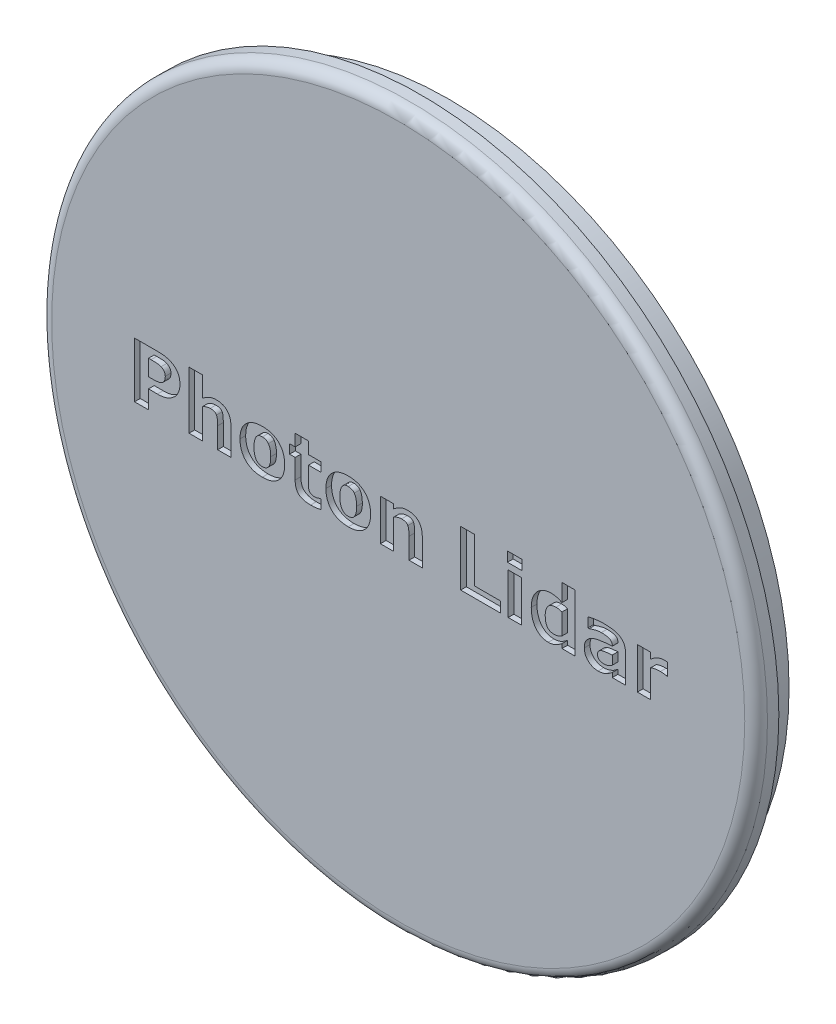
from build123d import *

# Parameters (mm, degrees)
ESBO_O1_R                = 31.5
RESSALTO_EXTRUS_O1_DEPTH = 2
ESBO_O3_R                = 29.9
ESBO_O3_R_2              = 28.4
RESSALTO_EXTRUS_O2_DEPTH = 2.5
FILETE1_R                = 1
ESBO_O6_W                = 1.167782709
ESBO_O6_H                = 3.626272622
ESBO_O6_W_2              = 1.290707204
ESBO_O6_H_2              = 0.86047147
CORTE_EXTRUS_O1_DEPTH    = 0.5


with BuildPart() as part:
    # Esboço1 → Ressalto-extrusão1 (new body)
    with BuildSketch(Plane.XY):
        Circle(ESBO_O1_R)
    extrude(amount=RESSALTO_EXTRUS_O1_DEPTH)

    # Esboço3 → Ressalto-extrusão2 (add)
    with BuildSketch(Plane(origin=(0, 0, 0), x_dir=(-1, 0, 0), z_dir=(0, 0, -1))):
        with Locations(Location((0, 0, 0), (0, 0, 180))):
            Circle(ESBO_O3_R)
        Circle(ESBO_O3_R_2, mode=Mode.SUBTRACT)
    extrude(amount=RESSALTO_EXTRUS_O2_DEPTH)

    # Filete1
    filete1_edges = [part.edges().sort_by_distance(p)[0] for p in [
        (-31.5, 0, 2),
    ]]
    fillet(filete1_edges, radius=FILETE1_R)

    # Esboço6 → Corte-extrusão1 (cut)
    # profile 1 of 12: a face of its own
    with BuildSketch(Plane.XY.offset(2)):
        with BuildLine():
            add(Edge.make_bspline(
                [(-19.206952445, 0.830485554), (-19.208048858, 0.776618625), (-19.210238032, 0.669064159), (-19.234110671, 0.508910752), (-19.268571468, 0.350088014), (-19.320080514, 0.195578514), (-19.381939229, 0.047692162), (-19.457919589, -0.089405093), (-19.545287152, -0.214933632), (-19.614491065, -0.288455918), (-19.648712351, -0.324812636)],
                knots=[0, 0, 0, 0, 1.019113673, 2.034833419, 3.059716062, 4.092791828, 5.113850101, 6.090481864, 7.05574463, 8, 8, 8, 8], degree=3))
            add(Edge.make_bspline(
                [(-19.648712351, -0.324812636), (-19.697828559, -0.370277733), (-19.795182329, -0.460394597), (-19.954261358, -0.577349265), (-20.121612581, -0.677553725), (-20.268921237, -0.745244208), (-20.391716518, -0.792474411), (-20.490207327, -0.819949152), (-20.592868266, -0.847155076), (-20.701896924, -0.866180132), (-20.816086317, -0.883461575), (-20.936135774, -0.892562826), (-21.061251787, -0.901604953), (-21.146515017, -0.901854222), (-21.190070285, -0.901981557)],
                knots=[0, 0, 0, 0, 1.421898893, 2.818361258, 4.188526452, 5.561662783, 6.259388046, 6.982920217, 7.733902613, 8.516058252, 9.334100428, 10.18803952, 11.074390857, 12, 12, 12, 12], degree=3))
            Line((-21.190070285, -0.901981557), (-21.972753597, -0.901981557))
            Line((-21.972753597, -0.901981557), (-21.972753597, -2.5))
            Line((-21.972753597, -2.5), (-23.201998554, -2.5))
            Line((-23.201998554, -2.5), (-23.201998554, 2.355517578))
            Line((-23.201998554, 2.355517578), (-21.14781499, 2.355517578))
            add(Edge.make_bspline(
                [(-21.14781499, 2.355517578), (-21.073837122, 2.354775146), (-20.931789006, 2.353349571), (-20.727567258, 2.337615558), (-20.541458368, 2.313399702), (-20.371736758, 2.279112776), (-20.216601418, 2.232630186), (-20.070630756, 2.179912054), (-19.934812818, 2.1141482), (-19.850017406, 2.062938935), (-19.808130057, 2.037642515)],
                knots=[0, 0, 0, 0, 1.27106079, 2.440619017, 3.517381815, 4.494852357, 5.412224011, 6.298180721, 7.159333057, 8, 8, 8, 8], degree=3))
            add(Edge.make_bspline(
                [(-19.808130057, 2.037642515), (-19.761322092, 2.004982545), (-19.668766306, 1.940402314), (-19.548967118, 1.822023059), (-19.443353895, 1.693015239), (-19.357739103, 1.548393224), (-19.289860323, 1.389950552), (-19.240881974, 1.216750581), (-19.212090158, 1.02832098), (-19.208700899, 0.897812405), (-19.206952445, 0.830485554)],
                knots=[0, 0, 0, 0, 0.969589194, 1.917218374, 2.854679868, 3.800052037, 4.766330684, 5.780154268, 6.854824506, 8, 8, 8, 8], degree=3))
        make_face()
        with BuildLine():
            add(Edge.make_bspline(
                [(-20.497659649, 0.796873387), (-20.498850267, 0.82899567), (-20.501187503, 0.892053152), (-20.522486184, 0.982933966), (-20.559095588, 1.06635688), (-20.607851462, 1.14129379), (-20.665429781, 1.207208593), (-20.728242767, 1.263406935), (-20.795597672, 1.309921299), (-20.844894468, 1.330965842), (-20.869314179, 1.341390489)],
                knots=[0, 0, 0, 0, 1.099847327, 2.159049679, 3.176161391, 4.2078443, 5.211073333, 6.166865038, 7.091936402, 8, 8, 8, 8], degree=3))
            add(Edge.make_bspline(
                [(-20.869314179, 1.341390489), (-20.901785853, 1.353177416), (-20.965661751, 1.376363795), (-21.063226084, 1.400648647), (-21.159317972, 1.419161912), (-21.257538656, 1.425579124), (-21.362266038, 1.429033429), (-21.479438417, 1.432280349), (-21.612304429, 1.432514694), (-21.706097609, 1.433213949), (-21.755715035, 1.433583861)],
                knots=[0, 0, 0, 0, 0.923486951, 1.81661585, 2.686744715, 3.537310919, 4.445705301, 5.490788035, 6.672604582, 8, 8, 8, 8], degree=3))
            Line((-21.755715035, 1.433583861), (-21.972753597, 1.433583861))
            Line((-21.972753597, 1.433583861), (-21.972753597, 0.019952161))
            Line((-21.972753597, 0.019952161), (-21.610702544, 0.019952161))
            add(Edge.make_bspline(
                [(-21.610702544, 0.019952161), (-21.559149777, 0.020086604), (-21.460780779, 0.020343139), (-21.320512876, 0.028599634), (-21.194509199, 0.039521872), (-21.081362183, 0.0553462), (-20.979211934, 0.078632273), (-20.8871836, 0.113200021), (-20.801994746, 0.154367544), (-20.752585088, 0.191655402), (-20.728143079, 0.21010099)],
                knots=[0, 0, 0, 0, 1.344387399, 2.565255935, 3.663631474, 4.642529432, 5.543743606, 6.389074971, 7.203106285, 8, 8, 8, 8], degree=3))
            add(Edge.make_bspline(
                [(-20.728143079, 0.21010099), (-20.708797806, 0.227575061), (-20.670878371, 0.261826678), (-20.622231075, 0.32065664), (-20.581702066, 0.383642832), (-20.550420481, 0.453070908), (-20.526744239, 0.528226302), (-20.509108133, 0.61081459), (-20.500233654, 0.701286066), (-20.498539333, 0.764205766), (-20.497659649, 0.796873387)],
                knots=[0, 0, 0, 0, 0.956932246, 1.875720723, 2.796014177, 3.701450989, 4.665012664, 5.687117245, 6.799161837, 8, 8, 8, 8], degree=3))
        make_face(mode=Mode.SUBTRACT)
    # profile 2 of 12: a face of its own
    with BuildSketch(Plane.XY.offset(2)):
        with BuildLine():
            Line((-14.720208354, -2.5), (-15.887991063, -2.5))
            Line((-15.887991063, -2.5), (-15.887991063, -0.675339518))
            add(Edge.make_bspline(
                [(-15.887991063, -0.675339518), (-15.888977907, -0.601027114), (-15.890946093, -0.452816693), (-15.907143123, -0.270405796), (-15.923346423, -0.132130824), (-15.941643134, -0.042980273), (-15.962530923, 0.032199453), (-15.982557295, 0.075206601), (-15.991708606, 0.094859275)],
                knots=[0, 0, 0, 0, 1.709235885, 3.408940626, 4.211008593, 4.910095588, 5.501954032, 6, 6, 6, 6], degree=3))
            add(Edge.make_bspline(
                [(-15.991708606, 0.094859275), (-16.003576873, 0.11419018), (-16.026846283, 0.152091143), (-16.072382072, 0.201230042), (-16.125630057, 0.241832553), (-16.187718705, 0.274119299), (-16.259806311, 0.297712177), (-16.342965508, 0.316486471), (-16.43939466, 0.324670939), (-16.507729672, 0.326365986), (-16.543908489, 0.3272634)],
                knots=[0, 0, 0, 0, 0.860145871, 1.686437142, 2.528070002, 3.393017362, 4.331453407, 5.402595683, 6.624848233, 8, 8, 8, 8], degree=3))
            add(Edge.make_bspline(
                [(-16.543908489, 0.3272634), (-16.598867591, 0.324516129), (-16.711089926, 0.31890641), (-16.850020414, 0.284257831), (-16.963002269, 0.244816604), (-17.052616717, 0.207223394), (-17.145674118, 0.1608714), (-17.207991003, 0.125568184), (-17.240160515, 0.107343794)],
                knots=[0, 0, 0, 0, 1.338419466, 2.732951426, 3.468143565, 4.254837763, 5.099104234, 6, 6, 6, 6], degree=3))
            Line((-17.240160515, 0.107343794), (-17.240160515, -2.5))
            Line((-17.240160515, -2.5), (-18.407943223, -2.5))
            Line((-18.407943223, -2.5), (-18.407943223, 2.539904322))
            Line((-18.407943223, 2.539904322), (-17.240160515, 2.539904322))
            Line((-17.240160515, 2.539904322), (-17.240160515, 0.745974963))
            add(Edge.make_bspline(
                [(-17.240160515, 0.745974963), (-17.188826165, 0.785131689), (-17.0889008, 0.861352585), (-16.934653027, 0.960085153), (-16.785554076, 1.047963052), (-16.637241233, 1.121384995), (-16.485530695, 1.179583232), (-16.326870303, 1.219184983), (-16.160971229, 1.245547932), (-16.047513669, 1.247966554), (-15.989787911, 1.249197117)],
                knots=[0, 0, 0, 0, 1.126064518, 2.191951536, 3.19307265, 4.144813015, 5.076393104, 6.021983703, 6.993610568, 8, 8, 8, 8], degree=3))
            add(Edge.make_bspline(
                [(-15.989787911, 1.249197117), (-15.941413778, 1.247964349), (-15.846978865, 1.245557766), (-15.70933656, 1.230519765), (-15.579625261, 1.20378216), (-15.458612419, 1.165043418), (-15.344866267, 1.117186796), (-15.239892077, 1.057390595), (-15.143168911, 0.986575809), (-15.054382413, 0.905928509), (-14.975228688, 0.814161261), (-14.906305299, 0.711400398), (-14.84942663, 0.597357469), (-14.800442621, 0.473680814), (-14.764792186, 0.338805678), (-14.739230262, 0.193588507), (-14.722215085, 0.037960322), (-14.720890645, -0.069633092), (-14.720208354, -0.12506033)],
                knots=[0, 0, 0, 0, 1.088441561, 2.124831547, 3.110816719, 4.062969431, 4.979391633, 5.88258537, 6.774334107, 7.671621258, 8.575503974, 9.49441354, 10.447872957, 11.437639084, 12.482478955, 13.580222388, 14.753440527, 16, 16, 16, 16], degree=3))
            Line((-14.720208354, -0.12506033), (-14.720208354, -2.5))
        make_face()
    # profile 3 of 12: a face of its own
    with BuildSketch(Plane.XY.offset(2)):
        with BuildLine():
            add(Edge.make_bspline(
                [(-9.987615271, -0.688784384), (-9.988825259, -0.761851758), (-9.991183849, -0.90427968), (-10.017219524, -1.111747201), (-10.057202897, -1.307446002), (-10.112231674, -1.491996337), (-10.185931312, -1.664029553), (-10.275390051, -1.824065178), (-10.38092914, -1.972264438), (-10.501846993, -2.107744375), (-10.637873619, -2.229044521), (-10.787120848, -2.335681074), (-10.950745309, -2.423422602), (-11.125968599, -2.497544478), (-11.314814588, -2.553679172), (-11.516760159, -2.593394902), (-11.731253116, -2.619339462), (-11.878781486, -2.621709547), (-11.954407202, -2.622924496)],
                knots=[0, 0, 0, 0, 1.120122129, 2.18341868, 3.201215738, 4.181270334, 5.131540819, 6.065757527, 6.988093576, 7.916512302, 8.844931028, 9.778115023, 10.722851943, 11.686686084, 12.691660064, 13.738321946, 14.84062285, 16, 16, 16, 16], degree=3))
            add(Edge.make_bspline(
                [(-11.954407202, -2.622924496), (-12.030034234, -2.621713541), (-12.177565173, -2.619351247), (-12.3920399, -2.593351385), (-12.593748756, -2.553889758), (-12.782368707, -2.497117338), (-12.957862208, -2.423697523), (-13.121678979, -2.335645543), (-13.270946427, -2.229054649), (-13.406959295, -2.107739029), (-13.527912032, -1.972275685), (-13.633325554, -1.824025579), (-13.723198224, -1.664289127), (-13.795078937, -1.491565033), (-13.852011406, -1.307676459), (-13.89147606, -1.111707885), (-13.917662688, -0.904290312), (-13.92000004, -0.761855363), (-13.921199132, -0.688784384)],
                knots=[0, 0, 0, 0, 1.159424321, 2.261770074, 3.308474541, 4.308788811, 5.277191138, 6.221966496, 7.15518846, 8.08364496, 9.01210146, 9.934475036, 10.868729753, 11.817121636, 12.798654016, 13.816492484, 14.879832297, 16, 16, 16, 16], degree=3))
            add(Edge.make_bspline(
                [(-13.921199132, -0.688784384), (-13.919979282, -0.61539694), (-13.917595946, -0.472012996), (-13.891600963, -0.26328048), (-13.851882001, -0.066114883), (-13.795556431, 0.118798433), (-13.721933533, 0.291246989), (-13.632542248, 0.451581261), (-13.525892372, 0.599508239), (-13.404043214, 0.734965129), (-13.267516082, 0.856177349), (-13.117289685, 0.961683154), (-12.954536659, 1.050862369), (-12.779388454, 1.124755256), (-12.590676086, 1.179844262), (-12.389806096, 1.219541949), (-12.176289876, 1.24566814), (-12.02971451, 1.247999377), (-11.954407202, 1.249197117)],
                knots=[0, 0, 0, 0, 1.124034801, 2.196132384, 3.217834281, 4.203147447, 5.152578239, 6.085969439, 7.010345409, 7.941219594, 8.872481455, 9.802010446, 10.748267785, 11.711250247, 12.709230373, 13.754967386, 14.846549946, 16, 16, 16, 16], degree=3))
            add(Edge.make_bspline(
                [(-11.954407202, 1.249197117), (-11.878139461, 1.247997218), (-11.729649183, 1.24566106), (-11.513902566, 1.219619029), (-11.311226941, 1.180166679), (-11.121977856, 1.123450843), (-10.946013521, 1.050459321), (-10.783490772, 0.96039206), (-10.633700069, 0.854816111), (-10.499286599, 0.731979848), (-10.378687253, 0.596270366), (-10.273693662, 0.447804175), (-10.184571778, 0.287204252), (-10.112916848, 0.114256767), (-10.055903242, -0.069895147), (-10.016067998, -0.265787446), (-9.991491716, -0.473356291), (-9.988929876, -0.615727009), (-9.987615271, -0.688784384)],
                knots=[0, 0, 0, 0, 1.167473013, 2.273023816, 3.322954552, 4.326451713, 5.293391623, 6.234801871, 7.166614545, 8.093305908, 9.017100806, 9.942078766, 10.872536262, 11.824015763, 12.804065898, 13.820367293, 14.881523901, 16, 16, 16, 16], degree=3))
        make_face()
        with BuildLine():
            add(Edge.make_bspline(
                [(-11.4300574, -1.586709411), (-11.412832655, -1.562422446), (-11.37777826, -1.512995599), (-11.33524684, -1.430685251), (-11.298361731, -1.341767747), (-11.268321291, -1.24338122), (-11.243551249, -1.131812233), (-11.228906046, -1.002804439), (-11.2176017, -0.855445024), (-11.2171171, -0.750915046), (-11.216860228, -0.695506818)],
                knots=[0, 0, 0, 0, 0.765094823, 1.557058493, 2.376706509, 3.238810155, 4.199844458, 5.312104478, 6.575226644, 8, 8, 8, 8], degree=3))
            add(Edge.make_bspline(
                [(-11.216860228, -0.695506818), (-11.21771912, -0.64331575), (-11.219364662, -0.543323349), (-11.228413882, -0.399611527), (-11.245343832, -0.2693173), (-11.269518399, -0.151940196), (-11.299125904, -0.046542064), (-11.334373821, 0.04776968), (-11.375088194, 0.131216702), (-11.40837116, 0.180025911), (-11.424295314, 0.203378557)],
                knots=[0, 0, 0, 0, 1.337076348, 2.561692668, 3.686680134, 4.69989255, 5.629188848, 6.488203485, 7.276684665, 8, 8, 8, 8], degree=3))
            add(Edge.make_bspline(
                [(-11.424295314, 0.203378557), (-11.440734797, 0.224637812), (-11.472841913, 0.266158182), (-11.529056845, 0.319745328), (-11.591230855, 0.362374318), (-11.658278113, 0.394841465), (-11.728231987, 0.419775001), (-11.801362019, 0.437062648), (-11.876941065, 0.447801268), (-11.928442518, 0.449387959), (-11.954407202, 0.450187896)],
                knots=[0, 0, 0, 0, 1.058499091, 2.067300666, 3.047512573, 4.018335651, 4.996351322, 5.969796037, 6.97646375, 8, 8, 8, 8], degree=3))
            add(Edge.make_bspline(
                [(-11.954407202, 0.450187896), (-11.980039601, 0.449652338), (-12.030175704, 0.448604804), (-12.103157884, 0.439936883), (-12.171895169, 0.425370399), (-12.237209909, 0.405745098), (-12.299610502, 0.376059615), (-12.359395377, 0.334845126), (-12.418408691, 0.282571603), (-12.454258351, 0.241283431), (-12.472994918, 0.219704466)],
                knots=[0, 0, 0, 0, 1.04189444, 2.037910168, 2.982338511, 3.896140384, 4.804271323, 5.778885192, 6.839150358, 8, 8, 8, 8], degree=3))
            add(Edge.make_bspline(
                [(-12.472994918, 0.219704466), (-12.489281959, 0.19670546), (-12.523464335, 0.148436369), (-12.564696838, 0.06490352), (-12.602050286, -0.029560145), (-12.635033279, -0.135951118), (-12.660825052, -0.255762952), (-12.678216946, -0.3897079), (-12.690097439, -0.53779801), (-12.691316943, -0.641381082), (-12.691954176, -0.695506818)],
                knots=[0, 0, 0, 0, 0.70629823, 1.482341141, 2.329662943, 3.254583898, 4.274063958, 5.401087491, 6.641978366, 8, 8, 8, 8], degree=3))
            add(Edge.make_bspline(
                [(-12.691954176, -0.695506818), (-12.691665746, -0.744194983), (-12.691107107, -0.83849553), (-12.67934728, -0.974563245), (-12.665420318, -1.101216709), (-12.641794844, -1.217169049), (-12.614029148, -1.323270676), (-12.577707763, -1.418030632), (-12.537730342, -1.503248516), (-12.503724525, -1.553150591), (-12.487400132, -1.577105935)],
                knots=[0, 0, 0, 0, 1.270983191, 2.461674417, 3.564986371, 4.596265355, 5.549463796, 6.425202083, 7.244022889, 8, 8, 8, 8], degree=3))
            add(Edge.make_bspline(
                [(-12.487400132, -1.577105935), (-12.470873776, -1.59734251), (-12.438291019, -1.637240196), (-12.382559616, -1.689492394), (-12.320992981, -1.731956671), (-12.255462021, -1.767061551), (-12.184251402, -1.793008602), (-12.108491482, -1.810970783), (-12.028013714, -1.821611137), (-11.973006223, -1.823134329), (-11.944803726, -1.823915274)],
                knots=[0, 0, 0, 0, 1.010886179, 1.993025998, 2.945391046, 3.898964935, 4.863589088, 5.87059323, 6.908247091, 8, 8, 8, 8], degree=3))
            add(Edge.make_bspline(
                [(-11.944803726, -1.823915274), (-11.895878166, -1.821365089), (-11.798874306, -1.816308882), (-11.681593093, -1.781523631), (-11.594113276, -1.740010011), (-11.533186339, -1.698281246), (-11.477915513, -1.646775459), (-11.446215547, -1.606989275), (-11.4300574, -1.586709411)],
                knots=[0, 0, 0, 0, 1.49343762, 2.961012893, 3.700518105, 4.446788108, 5.208294864, 6, 6, 6, 6], degree=3))
        make_face(mode=Mode.SUBTRACT)
    # profile 4 of 12: a face of its own
    with BuildSketch(Plane.XY.offset(2)):
        with BuildLine():
            add(Edge.make_bspline(
                [(-6.791578385, -2.517286257), (-6.856389396, -2.532833491), (-6.989026629, -2.564651264), (-7.161085145, -2.592081043), (-7.308659943, -2.608734961), (-7.432657913, -2.617187208), (-7.568145655, -2.621643106), (-7.662610415, -2.622486952), (-7.711591407, -2.622924496)],
                knots=[0, 0, 0, 0, 1.291346877, 2.642771225, 3.373109244, 4.169185184, 5.05070288, 6, 6, 6, 6], degree=3))
            add(Edge.make_bspline(
                [(-7.711591407, -2.622924496), (-7.766992531, -2.621885573), (-7.874098139, -2.619877051), (-8.029436992, -2.607803662), (-8.173594634, -2.586005989), (-8.306924675, -2.554779243), (-8.430084962, -2.517714854), (-8.541510816, -2.468987397), (-8.642151841, -2.412307205), (-8.732686204, -2.346601473), (-8.812941658, -2.270196016), (-8.880052018, -2.180184739), (-8.93867052, -2.079350092), (-8.98497835, -1.965374293), (-9.021795941, -1.839252655), (-9.046550222, -1.700795987), (-9.063790848, -1.550328062), (-9.065035851, -1.44591249), (-9.065681554, -1.391758844)],
                knots=[0, 0, 0, 0, 1.254406373, 2.425112466, 3.525000251, 4.551745933, 5.523718452, 6.432597655, 7.299226815, 8.134243947, 8.959515926, 9.797390618, 10.667618965, 11.593675357, 12.575328045, 13.637210109, 14.77457275, 16, 16, 16, 16], degree=3))
            Line((-9.065681554, -1.391758844), (-9.065681554, 0.3272634))
            Line((-9.065681554, 0.3272634), (-9.557379537, 0.3272634))
            Line((-9.557379537, 0.3272634), (-9.557379537, 1.126272622))
            Line((-9.557379537, 1.126272622), (-9.065681554, 1.126272622))
            Line((-9.065681554, 1.126272622), (-9.065681554, 2.171130835))
            Line((-9.065681554, 2.171130835), (-7.897898845, 2.171130835))
            Line((-7.897898845, 2.171130835), (-7.897898845, 1.126272622))
            Line((-7.897898845, 1.126272622), (-6.791578385, 1.126272622))
            Line((-6.791578385, 1.126272622), (-6.791578385, 0.3272634))
            Line((-6.791578385, 0.3272634), (-7.897898845, 0.3272634))
            Line((-7.897898845, 0.3272634), (-7.897898845, -0.977849019))
            add(Edge.make_bspline(
                [(-7.897898845, -0.977849019), (-7.897439036, -1.038049324), (-7.896578092, -1.150767952), (-7.897433319, -1.308970233), (-7.88589055, -1.450406862), (-7.856404595, -1.533966874), (-7.842198683, -1.574224892)],
                knots=[0, 0, 0, 0, 1.197914148, 2.242966005, 3.153486173, 4, 4, 4, 4], degree=3))
            add(Edge.make_bspline(
                [(-7.842198683, -1.574224892), (-7.833547826, -1.592832325), (-7.816483077, -1.629537491), (-7.779424592, -1.678790095), (-7.734176131, -1.722144155), (-7.678852471, -1.759394489), (-7.612418354, -1.79001797), (-7.532422205, -1.808290505), (-7.440656916, -1.822828982), (-7.374904496, -1.823538139), (-7.339936877, -1.823915274)],
                knots=[0, 0, 0, 0, 0.820729904, 1.618978142, 2.454031123, 3.322534162, 4.281603911, 5.367896211, 6.600227895, 8, 8, 8, 8], degree=3))
            add(Edge.make_bspline(
                [(-7.339936877, -1.823915274), (-7.323270341, -1.82321079), (-7.287552332, -1.821701011), (-7.230699282, -1.813622442), (-7.166937941, -1.799848654), (-7.099228849, -1.78109637), (-7.033186978, -1.761118491), (-6.974997131, -1.74113767), (-6.928340357, -1.721715244), (-6.901929333, -1.707252634), (-6.89049419, -1.700990778)],
                knots=[0, 0, 0, 0, 0.852790225, 1.827612483, 2.932246577, 4.187288435, 5.419917027, 6.460703747, 7.333533122, 8, 8, 8, 8], degree=3))
            Line((-6.89049419, -1.700990778), (-6.791578385, -1.700990778))
            Line((-6.791578385, -1.700990778), (-6.791578385, -2.517286257))
        make_face()
    # profile 5 of 12: a face of its own
    with BuildSketch(Plane.XY.offset(2)):
        with BuildLine():
            add(Edge.make_bspline(
                [(-2.427758789, -0.688784384), (-2.428968777, -0.761851758), (-2.431327367, -0.90427968), (-2.457363042, -1.111747201), (-2.497346415, -1.307446002), (-2.552375191, -1.491996337), (-2.626074829, -1.664029553), (-2.715533569, -1.824065178), (-2.821072658, -1.972264438), (-2.941990511, -2.107744375), (-3.078017137, -2.229044521), (-3.227264366, -2.335681074), (-3.390888827, -2.423422602), (-3.566112116, -2.497544478), (-3.754958106, -2.553679172), (-3.956903677, -2.593394902), (-4.171396634, -2.619339462), (-4.318925004, -2.621709547), (-4.394550719, -2.622924496)],
                knots=[0, 0, 0, 0, 1.120122129, 2.18341868, 3.201215738, 4.181270334, 5.131540819, 6.065757527, 6.988093576, 7.916512302, 8.844931028, 9.778115023, 10.722851943, 11.686686084, 12.691660064, 13.738321946, 14.84062285, 16, 16, 16, 16], degree=3))
            add(Edge.make_bspline(
                [(-4.394550719, -2.622924496), (-4.470177752, -2.621713541), (-4.61770869, -2.619351247), (-4.832183417, -2.593351385), (-5.033892274, -2.553889758), (-5.222512225, -2.497117338), (-5.398005725, -2.423697523), (-5.561822496, -2.335645543), (-5.711089945, -2.229054649), (-5.847102812, -2.107739029), (-5.96805555, -1.972275685), (-6.073469072, -1.824025579), (-6.163341742, -1.664289127), (-6.235222454, -1.491565033), (-6.292154924, -1.307676459), (-6.331619578, -1.111707885), (-6.357806206, -0.904290312), (-6.360143558, -0.761855363), (-6.36134265, -0.688784384)],
                knots=[0, 0, 0, 0, 1.159424321, 2.261770074, 3.308474541, 4.308788811, 5.277191138, 6.221966496, 7.15518846, 8.08364496, 9.01210146, 9.934475036, 10.868729753, 11.817121636, 12.798654016, 13.816492484, 14.879832297, 16, 16, 16, 16], degree=3))
            add(Edge.make_bspline(
                [(-6.36134265, -0.688784384), (-6.3601228, -0.61539694), (-6.357739464, -0.472012996), (-6.331744481, -0.26328048), (-6.292025519, -0.066114883), (-6.235699949, 0.118798433), (-6.16207705, 0.291246989), (-6.072685765, 0.451581261), (-5.96603589, 0.599508239), (-5.844186732, 0.734965129), (-5.7076596, 0.856177349), (-5.557433203, 0.961683154), (-5.394680176, 1.050862369), (-5.219531972, 1.124755256), (-5.030819604, 1.179844262), (-4.829949614, 1.219541949), (-4.616433394, 1.24566814), (-4.469858028, 1.247999377), (-4.394550719, 1.249197117)],
                knots=[0, 0, 0, 0, 1.124034801, 2.196132384, 3.217834281, 4.203147447, 5.152578239, 6.085969439, 7.010345409, 7.941219594, 8.872481455, 9.802010446, 10.748267785, 11.711250247, 12.709230373, 13.754967386, 14.846549946, 16, 16, 16, 16], degree=3))
            add(Edge.make_bspline(
                [(-4.394550719, 1.249197117), (-4.318282978, 1.247997218), (-4.169792701, 1.24566106), (-3.954046084, 1.219619029), (-3.751370459, 1.180166679), (-3.562121374, 1.123450843), (-3.386157039, 1.050459321), (-3.223634289, 0.96039206), (-3.073843587, 0.854816111), (-2.939430117, 0.731979848), (-2.818830771, 0.596270366), (-2.713837179, 0.447804175), (-2.624715296, 0.287204252), (-2.553060365, 0.114256767), (-2.49604676, -0.069895147), (-2.456211516, -0.265787446), (-2.431635233, -0.473356291), (-2.429073394, -0.615727009), (-2.427758789, -0.688784384)],
                knots=[0, 0, 0, 0, 1.167473013, 2.273023816, 3.322954552, 4.326451713, 5.293391623, 6.234801871, 7.166614545, 8.093305908, 9.017100806, 9.942078766, 10.872536262, 11.824015763, 12.804065898, 13.820367293, 14.881523901, 16, 16, 16, 16], degree=3))
        make_face()
        with BuildLine():
            add(Edge.make_bspline(
                [(-3.870200918, -1.586709411), (-3.852976172, -1.562422446), (-3.817921777, -1.512995599), (-3.775390357, -1.430685251), (-3.738505248, -1.341767747), (-3.708464809, -1.24338122), (-3.683694766, -1.131812233), (-3.669049564, -1.002804439), (-3.657745217, -0.855445024), (-3.657260617, -0.750915046), (-3.657003746, -0.695506818)],
                knots=[0, 0, 0, 0, 0.765094823, 1.557058493, 2.376706509, 3.238810155, 4.199844458, 5.312104478, 6.575226644, 8, 8, 8, 8], degree=3))
            add(Edge.make_bspline(
                [(-3.657003746, -0.695506818), (-3.657862637, -0.64331575), (-3.65950818, -0.543323349), (-3.668557399, -0.399611527), (-3.68548735, -0.2693173), (-3.709661917, -0.151940196), (-3.739269422, -0.046542064), (-3.774517339, 0.04776968), (-3.815231711, 0.131216702), (-3.848514678, 0.180025911), (-3.864438832, 0.203378557)],
                knots=[0, 0, 0, 0, 1.337076348, 2.561692668, 3.686680134, 4.69989255, 5.629188848, 6.488203485, 7.276684665, 8, 8, 8, 8], degree=3))
            add(Edge.make_bspline(
                [(-3.864438832, 0.203378557), (-3.880878315, 0.224637812), (-3.912985431, 0.266158182), (-3.969200363, 0.319745328), (-4.031374373, 0.362374318), (-4.09842163, 0.394841465), (-4.168375505, 0.419775001), (-4.241505537, 0.437062648), (-4.317084583, 0.447801268), (-4.368586036, 0.449387959), (-4.394550719, 0.450187896)],
                knots=[0, 0, 0, 0, 1.058499091, 2.067300666, 3.047512573, 4.018335651, 4.996351322, 5.969796037, 6.97646375, 8, 8, 8, 8], degree=3))
            add(Edge.make_bspline(
                [(-4.394550719, 0.450187896), (-4.420183119, 0.449652338), (-4.470319222, 0.448604804), (-4.543301402, 0.439936883), (-4.612038686, 0.425370399), (-4.677353426, 0.405745098), (-4.73975402, 0.376059615), (-4.799538894, 0.334845126), (-4.858552208, 0.282571603), (-4.894401869, 0.241283431), (-4.913138435, 0.219704466)],
                knots=[0, 0, 0, 0, 1.04189444, 2.037910168, 2.982338511, 3.896140384, 4.804271323, 5.778885192, 6.839150358, 8, 8, 8, 8], degree=3))
            add(Edge.make_bspline(
                [(-4.913138435, 0.219704466), (-4.929425477, 0.19670546), (-4.963607853, 0.148436369), (-5.004840355, 0.06490352), (-5.042193803, -0.029560145), (-5.075176797, -0.135951118), (-5.10096857, -0.255762952), (-5.118360464, -0.3897079), (-5.130240956, -0.53779801), (-5.13146046, -0.641381082), (-5.132097693, -0.695506818)],
                knots=[0, 0, 0, 0, 0.70629823, 1.482341141, 2.329662943, 3.254583898, 4.274063958, 5.401087491, 6.641978366, 8, 8, 8, 8], degree=3))
            add(Edge.make_bspline(
                [(-5.132097693, -0.695506818), (-5.131809263, -0.744194983), (-5.131250625, -0.83849553), (-5.119490797, -0.974563245), (-5.105563836, -1.101216709), (-5.081938361, -1.217169049), (-5.054172665, -1.323270676), (-5.01785128, -1.418030632), (-4.977873859, -1.503248516), (-4.943868042, -1.553150591), (-4.92754365, -1.577105935)],
                knots=[0, 0, 0, 0, 1.270983191, 2.461674417, 3.564986371, 4.596265355, 5.549463796, 6.425202083, 7.244022889, 8, 8, 8, 8], degree=3))
            add(Edge.make_bspline(
                [(-4.92754365, -1.577105935), (-4.911017293, -1.59734251), (-4.878434537, -1.637240196), (-4.822703133, -1.689492394), (-4.761136498, -1.731956671), (-4.695605538, -1.767061551), (-4.62439492, -1.793008602), (-4.548635, -1.810970783), (-4.468157232, -1.821611137), (-4.413149741, -1.823134329), (-4.384947243, -1.823915274)],
                knots=[0, 0, 0, 0, 1.010886179, 1.993025998, 2.945391046, 3.898964935, 4.863589088, 5.87059323, 6.908247091, 8, 8, 8, 8], degree=3))
            add(Edge.make_bspline(
                [(-4.384947243, -1.823915274), (-4.336021683, -1.821365089), (-4.239017823, -1.816308882), (-4.121736611, -1.781523631), (-4.034256793, -1.740010011), (-3.973329857, -1.698281246), (-3.918059031, -1.646775459), (-3.886359065, -1.606989275), (-3.870200918, -1.586709411)],
                knots=[0, 0, 0, 0, 1.49343762, 2.961012893, 3.700518105, 4.446788108, 5.208294864, 6, 6, 6, 6], degree=3))
        make_face(mode=Mode.SUBTRACT)
    # profile 6 of 12: a face of its own
    with BuildSketch(Plane.XY.offset(2)):
        with BuildLine():
            Line((2.12044755, -2.5), (0.952664841, -2.5))
            Line((0.952664841, -2.5), (0.952664841, -0.675339518))
            add(Edge.make_bspline(
                [(0.952664841, -0.675339518), (0.951677997, -0.601027114), (0.94970981, -0.452816693), (0.933512781, -0.270405796), (0.91730948, -0.132130824), (0.89901277, -0.042980273), (0.878124981, 0.032199453), (0.858098609, 0.075206601), (0.848947298, 0.094859275)],
                knots=[0, 0, 0, 0, 1.709235885, 3.408940626, 4.211008593, 4.910095588, 5.501954032, 6, 6, 6, 6], degree=3))
            add(Edge.make_bspline(
                [(0.848947298, 0.094859275), (0.837079031, 0.11419018), (0.813809621, 0.152091143), (0.768273832, 0.201230042), (0.715025847, 0.241832553), (0.652937199, 0.274119299), (0.580849593, 0.297712177), (0.497690396, 0.316486471), (0.401261244, 0.324670939), (0.332926231, 0.326365986), (0.296747415, 0.3272634)],
                knots=[0, 0, 0, 0, 0.860145871, 1.686437142, 2.528070002, 3.393017362, 4.331453407, 5.402595683, 6.624848233, 8, 8, 8, 8], degree=3))
            add(Edge.make_bspline(
                [(0.296747415, 0.3272634), (0.241788313, 0.324516129), (0.129565978, 0.31890641), (-0.009364511, 0.284257831), (-0.122346365, 0.244816604), (-0.211960813, 0.207223394), (-0.305018214, 0.1608714), (-0.367335099, 0.125568184), (-0.399504611, 0.107343794)],
                knots=[0, 0, 0, 0, 1.338419466, 2.732951426, 3.468143565, 4.254837763, 5.099104234, 6, 6, 6, 6], degree=3))
            Line((-0.399504611, 0.107343794), (-0.399504611, -2.5))
            Line((-0.399504611, -2.5), (-1.56728732, -2.5))
            Line((-1.56728732, -2.5), (-1.56728732, 1.126272622))
            Line((-1.56728732, 1.126272622), (-0.399504611, 1.126272622))
            Line((-0.399504611, 1.126272622), (-0.399504611, 0.745974963))
            add(Edge.make_bspline(
                [(-0.399504611, 0.745974963), (-0.348170261, 0.785131689), (-0.248244896, 0.861352585), (-0.093997123, 0.960085153), (0.055101827, 1.047963052), (0.203414671, 1.121384995), (0.355125209, 1.179583232), (0.513785601, 1.219184983), (0.679684675, 1.245547932), (0.793142235, 1.247966554), (0.850867993, 1.249197117)],
                knots=[0, 0, 0, 0, 1.126064518, 2.191951536, 3.19307265, 4.144813015, 5.076393104, 6.021983703, 6.993610568, 8, 8, 8, 8], degree=3))
            add(Edge.make_bspline(
                [(0.850867993, 1.249197117), (0.899242126, 1.247964349), (0.993677039, 1.245557766), (1.131319344, 1.230519765), (1.261030643, 1.20378216), (1.382043484, 1.165043418), (1.495789636, 1.117186796), (1.600763827, 1.057390595), (1.697486993, 0.986575809), (1.786273491, 0.905928509), (1.865427216, 0.814161261), (1.934350605, 0.711400398), (1.991229274, 0.597357469), (2.040213283, 0.473680814), (2.075863718, 0.338805678), (2.101425642, 0.193588507), (2.118440818, 0.037960322), (2.119765259, -0.069633092), (2.12044755, -0.12506033)],
                knots=[0, 0, 0, 0, 1.088441561, 2.124831547, 3.110816719, 4.062969431, 4.979391633, 5.88258537, 6.774334107, 7.671621258, 8.575503974, 9.49441354, 10.447872957, 11.437639084, 12.482478955, 13.580222388, 14.753440527, 16, 16, 16, 16], degree=3))
            Line((2.12044755, -0.12506033), (2.12044755, -2.5))
        make_face()
    # profile 7 of 12: a face of its own
    with BuildSketch(Plane.XY.offset(2)):
        Polygon((9.004219306, -2.5), (5.50087118, -2.5), (5.50087118, 2.355517578), (6.730116137, 2.355517578), (6.730116137, -1.578066283), (9.004219306, -1.578066283), align=None)
    # profile 8 of 12: a face of its own
    with BuildSketch(Plane.XY.offset(2)):
        with Locations((10.264195387, -0.686863689)):
            Rectangle(ESBO_O6_W, ESBO_O6_H)
    # profile 9 of 12: a face of its own
    with BuildSketch(Plane.XY.offset(2)):
        with Locations((10.264195387, 2.109668587)):
            Rectangle(ESBO_O6_W_2, ESBO_O6_H_2)
    # profile 10 of 12: a face of its own
    with BuildSketch(Plane.XY.offset(2)):
        with BuildLine():
            Line((15.580679823, -2.5), (14.412897115, -2.5))
            Line((14.412897115, -2.5), (14.412897115, -2.120662689))
            add(Edge.make_bspline(
                [(14.412897115, -2.120662689), (14.362386719, -2.159917512), (14.264966008, -2.23562931), (14.117253766, -2.337102781), (13.974614088, -2.423459285), (13.835358683, -2.496830531), (13.692694102, -2.554651948), (13.541412769, -2.594383353), (13.379418619, -2.619119691), (13.267935787, -2.621631407), (13.210541892, -2.622924496)],
                knots=[0, 0, 0, 0, 1.152291314, 2.222454189, 3.226340712, 4.154912587, 5.055556546, 5.992827177, 6.96666181, 8, 8, 8, 8], degree=3))
            add(Edge.make_bspline(
                [(13.210541892, -2.622924496), (13.155060545, -2.621671248), (13.046067722, -2.619209249), (12.887355009, -2.593298912), (12.737051516, -2.552816792), (12.594578039, -2.497446634), (12.461649767, -2.423443452), (12.336637528, -2.334603235), (12.220824338, -2.228956513), (12.114801003, -2.107818132), (12.018502882, -1.973754462), (11.936259727, -1.826315308), (11.86418753, -1.668812101), (11.808778653, -1.49859627), (11.762902686, -1.318792743), (11.731923259, -1.127248968), (11.712386464, -0.924797547), (11.709854063, -0.785826489), (11.708558211, -0.71471377)],
                knots=[0, 0, 0, 0, 0.974076638, 1.913568576, 2.816802883, 3.70563253, 4.591735235, 5.482910833, 6.394720341, 7.339182639, 8.306856542, 9.289131547, 10.30110225, 11.345153709, 12.429645291, 13.558655777, 14.750742583, 16, 16, 16, 16], degree=3))
            add(Edge.make_bspline(
                [(11.708558211, -0.71471377), (11.710101452, -0.638765525), (11.713099864, -0.49120328), (11.739668952, -0.276519367), (11.78223805, -0.075065761), (11.842949558, 0.113016243), (11.91948974, 0.287366871), (12.007757846, 0.449252886), (12.10851672, 0.598770578), (12.18649988, 0.688147007), (12.225225231, 0.732530097)],
                knots=[0, 0, 0, 0, 1.157776749, 2.249481031, 3.293119714, 4.293481705, 5.257548222, 6.192578294, 7.10245955, 8, 8, 8, 8], degree=3))
            add(Edge.make_bspline(
                [(12.225225231, 0.732530097), (12.264034941, 0.772231879), (12.341469679, 0.851446518), (12.474048422, 0.953376296), (12.617851731, 1.042274617), (12.772597821, 1.116331186), (12.933146619, 1.175263188), (13.095771254, 1.218134223), (13.258377979, 1.243819086), (13.366991225, 1.247414146), (13.420858021, 1.249197117)],
                knots=[0, 0, 0, 0, 0.99463639, 1.984539671, 2.989854726, 4.022069618, 5.055513062, 6.052515845, 7.034144224, 8, 8, 8, 8], degree=3))
            add(Edge.make_bspline(
                [(13.420858021, 1.249197117), (13.474342078, 1.248188775), (13.57634312, 1.246265735), (13.722112457, 1.234250727), (13.852765279, 1.213084254), (14.007953649, 1.170016853), (14.194110024, 1.101380483), (14.338704887, 1.035956895), (14.412897115, 1.002387778)],
                knots=[0, 0, 0, 0, 0.932079994, 1.777597584, 2.547090245, 3.234553591, 4.581037903, 6, 6, 6, 6], degree=3))
            Line((14.412897115, 1.002387778), (14.412897115, 2.539904322))
            Line((14.412897115, 2.539904322), (15.580679823, 2.539904322))
            Line((15.580679823, 2.539904322), (15.580679823, -2.5))
        make_face()
        with BuildLine():
            Line((14.412897115, -1.539652378), (14.412897115, 0.288849495))
            add(Edge.make_bspline(
                [(14.412897115, 0.288849495), (14.369718249, 0.305388723), (14.282667535, 0.33873262), (14.146892662, 0.367005359), (14.014836405, 0.384863024), (13.928614743, 0.38748026), (13.887586965, 0.388725648)],
                knots=[0, 0, 0, 0, 1.030062441, 2.076656454, 3.084794839, 4, 4, 4, 4], degree=3))
            add(Edge.make_bspline(
                [(13.887586965, 0.388725648), (13.849138204, 0.387763993), (13.774556016, 0.385898592), (13.666379169, 0.372662061), (13.566125096, 0.34939022), (13.472444876, 0.318214015), (13.387223229, 0.274962481), (13.307412345, 0.225784128), (13.236637025, 0.164895514), (13.173412175, 0.095704066), (13.117289983, 0.018390873), (13.069688007, -0.066763405), (13.027781162, -0.157955276), (12.995541356, -0.257093694), (12.969867803, -0.36274894), (12.9501823, -0.475594939), (12.940236264, -0.595769587), (12.938627892, -0.678205312), (12.937803167, -0.720475856)],
                knots=[0, 0, 0, 0, 1.109264133, 2.151729831, 3.137503124, 4.075067414, 4.992025402, 5.888807327, 6.773378448, 7.675471311, 8.588093335, 9.522878571, 10.485979328, 11.478994712, 12.525095338, 13.621364365, 14.78030765, 16, 16, 16, 16], degree=3))
            add(Edge.make_bspline(
                [(12.937803167, -0.720475856), (12.938321705, -0.764666283), (12.939318532, -0.849617071), (12.947881018, -0.972775438), (12.962840307, -1.086372398), (12.984425921, -1.190777536), (13.00919581, -1.286064399), (13.042449921, -1.371879367), (13.081365892, -1.448168795), (13.125864063, -1.516348378), (13.178520624, -1.574379291), (13.237868414, -1.624602375), (13.303378609, -1.668641019), (13.377441489, -1.703005246), (13.458376271, -1.729772865), (13.546264681, -1.748743204), (13.641100634, -1.760470217), (13.706685536, -1.761776477), (13.740653779, -1.762453026)],
                knots=[0, 0, 0, 0, 1.399166673, 2.689729869, 3.906826941, 5.024050692, 6.064215016, 7.020489948, 7.931703818, 8.772299744, 9.590535222, 10.403037026, 11.229580945, 12.082011276, 12.979534716, 13.923970963, 14.924766888, 16, 16, 16, 16], degree=3))
            add(Edge.make_bspline(
                [(13.740653779, -1.762453026), (13.768542321, -1.761694827), (13.825188302, -1.760154807), (13.911253212, -1.747890926), (13.999527036, -1.728696932), (14.089091613, -1.701996738), (14.176910599, -1.668329454), (14.261797968, -1.631891057), (14.339873072, -1.587972363), (14.388754573, -1.55562749), (14.412897115, -1.539652378)],
                knots=[0, 0, 0, 0, 0.931666035, 1.892359102, 2.899516494, 3.94874482, 5.011734461, 6.041421349, 7.03265928, 8, 8, 8, 8], degree=3))
        make_face(mode=Mode.SUBTRACT)
    # profile 11 of 12: a face of its own
    with BuildSketch(Plane.XY.offset(2)):
        with BuildLine():
            add(Edge.make_bspline(
                [(18.838178958, -2.113940256), (18.803275339, -2.140178529), (18.726302683, -2.198041571), (18.606571149, -2.288491187), (18.478679271, -2.375813493), (18.388229571, -2.422986041), (18.345520628, -2.445260186)],
                knots=[0, 0, 0, 0, 0.8810866, 1.94305285, 3.028741502, 4, 4, 4, 4], degree=3))
            add(Edge.make_bspline(
                [(18.345520628, -2.445260186), (18.288365616, -2.471043448), (18.173686972, -2.522776263), (18.02268716, -2.570512847), (17.897193725, -2.596965776), (17.798899484, -2.612891469), (17.695833486, -2.621265058), (17.625593364, -2.622363569), (17.589727049, -2.622924496)],
                knots=[0, 0, 0, 0, 1.440057947, 2.889403546, 3.626613506, 4.386055881, 5.175880884, 6, 6, 6, 6], degree=3))
            add(Edge.make_bspline(
                [(17.589727049, -2.622924496), (17.547742941, -2.622104745), (17.465082516, -2.620490779), (17.343560369, -2.604659697), (17.227476852, -2.579043321), (17.116757244, -2.542804981), (17.01081674, -2.49816819), (16.910273842, -2.441785345), (16.815187508, -2.375379736), (16.725962018, -2.299653752), (16.645033666, -2.21614034), (16.574134955, -2.125580668), (16.513216686, -2.030183044), (16.465406639, -1.927741115), (16.426184154, -1.821002409), (16.399976013, -1.70807448), (16.382942709, -1.589787539), (16.380790547, -1.508983022), (16.379689045, -1.467626306)],
                knots=[0, 0, 0, 0, 1.076201875, 2.118880445, 3.136635514, 4.120554081, 5.102552939, 6.080115265, 7.070757533, 8.072494474, 9.076885294, 10.047459754, 11.017721702, 11.972439409, 12.941032925, 13.928643251, 14.939854913, 16, 16, 16, 16], degree=3))
            add(Edge.make_bspline(
                [(16.379689045, -1.467626306), (16.380178619, -1.434630272), (16.381131031, -1.370440064), (16.390382938, -1.27653639), (16.403395116, -1.186941919), (16.422386328, -1.101790732), (16.447347205, -1.021426827), (16.478593863, -0.946275385), (16.51368113, -0.874833694), (16.569253249, -0.786249229), (16.652624718, -0.684658953), (16.769537099, -0.574984071), (16.906209167, -0.48031299), (17.007063741, -0.430171056), (17.058654814, -0.404521488)],
                knots=[0, 0, 0, 0, 0.883069005, 1.717915037, 2.523891204, 3.305628877, 4.051008897, 4.773524101, 5.482546585, 6.179291826, 7.568559599, 8.987381223, 10.458927238, 12, 12, 12, 12], degree=3))
            add(Edge.make_bspline(
                [(17.058654814, -0.404521488), (17.115261718, -0.380776172), (17.232698581, -0.331514063), (17.423673409, -0.275079444), (17.633191204, -0.228043152), (17.941184231, -0.181358163), (18.346878637, -0.136339821), (18.677057872, -0.114217838), (18.844901392, -0.102972335)],
                knots=[0, 0, 0, 0, 0.606550189, 1.258350938, 1.965555212, 2.728387474, 4.336906433, 6, 6, 6, 6], degree=3))
            Line((18.844901392, -0.102972335), (18.844901392, -0.083765382))
            add(Edge.make_bspline(
                [(18.844901392, -0.083765382), (18.844250582, -0.059380885), (18.843000866, -0.012556586), (18.831016682, 0.054852883), (18.812378847, 0.116533857), (18.784689424, 0.17231661), (18.750356091, 0.222714986), (18.707106869, 0.266442415), (18.656569286, 0.304199862), (18.598133823, 0.335903928), (18.53231206, 0.362109528), (18.4602957, 0.386350038), (18.380690714, 0.406529905), (18.293711853, 0.422436811), (18.19947565, 0.434915619), (18.098178224, 0.443090874), (17.989626582, 0.449260831), (17.914654473, 0.449872038), (17.875910641, 0.450187896)],
                knots=[0, 0, 0, 0, 0.933381424, 1.792324498, 2.614677019, 3.393536278, 4.169202487, 4.941078061, 5.738261436, 6.578079077, 7.47998911, 8.449571871, 9.487704817, 10.623069256, 11.835505264, 13.127984906, 14.515809783, 16, 16, 16, 16], degree=3))
            add(Edge.make_bspline(
                [(17.875910641, 0.450187896), (17.82720182, 0.449080962), (17.727536372, 0.446816013), (17.575980067, 0.427705951), (17.419586787, 0.396464931), (17.263557572, 0.355128087), (17.117570345, 0.309288779), (16.988853604, 0.270394196), (16.88353203, 0.236068614), (16.82109523, 0.214040014), (16.79359887, 0.204338904)],
                knots=[0, 0, 0, 0, 1.048023305, 2.144410588, 3.282079539, 4.478558128, 5.616227078, 6.575084586, 7.372485689, 8, 8, 8, 8], degree=3))
            Line((16.79359887, 0.204338904), (16.687000284, 0.204338904))
            Line((16.687000284, 0.204338904), (16.687000284, 1.07057246))
            add(Edge.make_bspline(
                [(16.687000284, 1.07057246), (16.722817308, 1.079052234), (16.80347681, 1.098148584), (16.939441015, 1.126128367), (17.10464964, 1.153792991), (17.293549002, 1.185425341), (17.497321568, 1.214391092), (17.706289231, 1.233819706), (17.915427958, 1.247284376), (18.054833986, 1.248558905), (18.124640675, 1.249197117)],
                knots=[0, 0, 0, 0, 0.608470133, 1.370267334, 2.294240832, 3.377404961, 4.536701096, 5.695707305, 6.846139977, 8, 8, 8, 8], degree=3))
            add(Edge.make_bspline(
                [(18.124640675, 1.249197117), (18.204692197, 1.248335613), (18.359491236, 1.246669687), (18.582900843, 1.232276077), (18.789097239, 1.208713315), (18.977829186, 1.175548036), (19.149652757, 1.132517095), (19.304576522, 1.080438572), (19.442272292, 1.018086938), (19.562822922, 0.945520423), (19.668382835, 0.862993542), (19.759283891, 0.769355979), (19.836019385, 0.664219948), (19.898757373, 0.548294954), (19.946689271, 0.421187827), (19.981049753, 0.283608628), (20.002660049, 0.135236232), (20.004839416, 0.032513786), (20.005961667, -0.020382439)],
                knots=[0, 0, 0, 0, 1.480063768, 2.862062364, 4.137357851, 5.315847786, 6.402589936, 7.409632567, 8.334012638, 9.191787993, 10.005288935, 10.804801901, 11.596830273, 12.404626309, 13.234584812, 14.101683314, 15.022474726, 16, 16, 16, 16], degree=3))
            Line((20.005961667, -0.020382439), (20.005961667, -2.5))
            Line((20.005961667, -2.5), (18.838178958, -2.5))
            Line((18.838178958, -2.5), (18.838178958, -2.113940256))
        make_face()
        with BuildLine():
            Line((18.838178958, -1.557898983), (18.838178958, -0.779057061))
            add(Edge.make_bspline(
                [(18.838178958, -0.779057061), (18.755872946, -0.786708738), (18.584648187, -0.802626854), (18.370557588, -0.828302238), (18.201197514, -0.851559066), (18.088335761, -0.870444916), (17.992091974, -0.891037542), (17.934097672, -0.907778203), (17.907602112, -0.915426423)],
                knots=[0, 0, 0, 0, 1.579738006, 3.286397354, 4.120462124, 4.846646492, 5.473073275, 6, 6, 6, 6], degree=3))
            add(Edge.make_bspline(
                [(17.907602112, -0.915426423), (17.879815762, -0.925363068), (17.826529593, -0.944418672), (17.753160371, -0.982188634), (17.690551961, -1.027091088), (17.63852374, -1.07886491), (17.596484294, -1.137725406), (17.568183997, -1.206021985), (17.550255353, -1.282643413), (17.548429122, -1.336589065), (17.547471754, -1.36486911)],
                knots=[0, 0, 0, 0, 1.134645455, 2.17592122, 3.163961801, 4.087224143, 4.989373906, 5.927471995, 6.913514204, 8, 8, 8, 8], degree=3))
            add(Edge.make_bspline(
                [(17.547471754, -1.36486911), (17.548410292, -1.400080838), (17.550109703, -1.463838769), (17.56170995, -1.553925954), (17.599828149, -1.633212634), (17.641886546, -1.672837124), (17.664634164, -1.694268345)],
                knots=[0, 0, 0, 0, 1.1633361, 2.106454559, 2.975860905, 4, 4, 4, 4], degree=3))
            add(Edge.make_bspline(
                [(17.664634164, -1.694268345), (17.691057129, -1.714715975), (17.745025242, -1.756479647), (17.82792882, -1.790563598), (17.906181475, -1.80721973), (17.980264087, -1.817865507), (18.068871573, -1.822896993), (18.132639543, -1.823559417), (18.16689597, -1.823915274)],
                knots=[0, 0, 0, 0, 1.128733193, 2.305403657, 2.994957252, 3.838787388, 4.838987289, 6, 6, 6, 6], degree=3))
            add(Edge.make_bspline(
                [(18.16689597, -1.823915274), (18.196071817, -1.822887531), (18.255038759, -1.820810372), (18.343908629, -1.806969985), (18.433149928, -1.783651831), (18.522115235, -1.752046362), (18.608589081, -1.712745235), (18.691512795, -1.668295325), (18.767623982, -1.615750281), (18.814747352, -1.577111644), (18.838178958, -1.557898983)],
                knots=[0, 0, 0, 0, 0.950493584, 1.921030753, 2.922727847, 3.951900201, 4.992842113, 6.014962171, 7.012960544, 8, 8, 8, 8], degree=3))
        make_face(mode=Mode.SUBTRACT)
    # profile 12 of 12: a face of its own
    with BuildSketch(Plane.XY.offset(2)):
        with BuildLine():
            Line((23.693696536, 0.019952161), (23.589978993, 0.019952161))
            add(Edge.make_bspline(
                [(23.589978993, 0.019952161), (23.575660074, 0.025049793), (23.543692769, 0.03643037), (23.488801855, 0.047911461), (23.422817202, 0.058633823), (23.348691146, 0.066299358), (23.272161776, 0.072878229), (23.199798225, 0.077630725), (23.134161731, 0.080775135), (23.092842088, 0.08120923), (23.073311972, 0.081414409)],
                knots=[0, 0, 0, 0, 0.697795818, 1.557844694, 2.571184754, 3.770094633, 4.980769819, 6.101209641, 7.102518949, 8, 8, 8, 8], degree=3))
            add(Edge.make_bspline(
                [(23.073311972, 0.081414409), (23.032652378, 0.081041986), (22.953850756, 0.080320199), (22.83942225, 0.074886126), (22.732436318, 0.064116798), (22.596539218, 0.04483344), (22.42450982, 0.006171625), (22.28930919, -0.038378676), (22.218602589, -0.061677387)],
                knots=[0, 0, 0, 0, 0.839947433, 1.627886858, 2.365518671, 3.060380964, 4.462651598, 6, 6, 6, 6], degree=3))
            Line((22.218602589, -0.061677387), (22.218602589, -2.5))
            Line((22.218602589, -2.5), (21.05081988, -2.5))
            Line((21.05081988, -2.5), (21.05081988, 1.126272622))
            Line((21.05081988, 1.126272622), (22.218602589, 1.126272622))
            Line((22.218602589, 1.126272622), (22.218602589, 0.591358996))
            add(Edge.make_bspline(
                [(22.218602589, 0.591358996), (22.250092251, 0.618175811), (22.3112761, 0.6702804), (22.403523032, 0.741940555), (22.492208508, 0.807176125), (22.57838752, 0.863831253), (22.660061588, 0.916107171), (22.739865415, 0.958578291), (22.815624343, 0.995998301), (22.911956049, 1.033368112), (23.027955301, 1.068999529), (23.162262756, 1.103122678), (23.291760403, 1.121522113), (23.376093676, 1.124718018), (23.417116421, 1.126272622)],
                knots=[0, 0, 0, 0, 1.109224998, 2.155204232, 3.132388941, 4.061108113, 4.921167674, 5.731807236, 6.484492504, 7.18602799, 8.500332988, 9.737314791, 10.899348303, 12, 12, 12, 12], degree=3))
            add(Edge.make_bspline(
                [(23.417116421, 1.126272622), (23.439207738, 1.126078473), (23.485967796, 1.125667525), (23.557023537, 1.12246717), (23.627171015, 1.119181761), (23.672576077, 1.115500476), (23.693696536, 1.113788103)],
                knots=[0, 0, 0, 0, 0.957237496, 2.02615725, 3.08185424, 4, 4, 4, 4], degree=3))
            Line((23.693696536, 1.113788103), (23.693696536, 0.019952161))
        make_face()
    extrude(amount=-CORTE_EXTRUS_O1_DEPTH, mode=Mode.SUBTRACT)


solid = part.part
